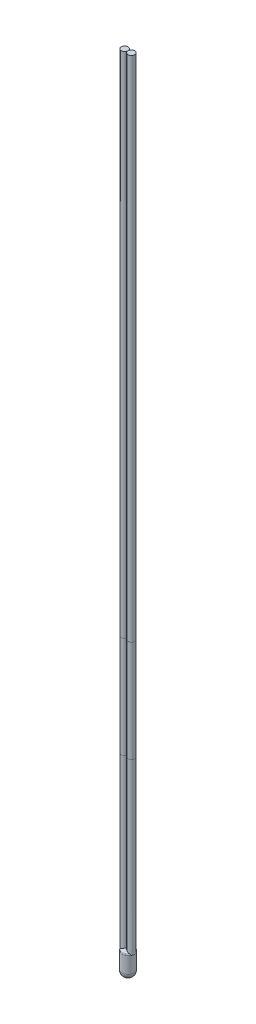
from build123d import *

# Parameters (mm, degrees)
REDONDEO1_R               = 0.2
CROQUIS2_R                = 0.5
SALIENTE_EXTRUIR1_DEPTH   = 25
SALIENTE_EXTRUIR6_START   = -25
CROQUIS2_3_R              = 0.5
SALIENTE_EXTRUIR6_DEPTH   = 15
SALIENTE_EXTRUIR6_2_DEPTH = 15
SALIENTE_EXTRUIR7_START   = -40
CROQUIS2_4_R              = 0.5
SALIENTE_EXTRUIR7_DEPTH   = 75
SALIENTE_EXTRUIR7_2_DEPTH = 75


with BuildPart() as part:
    # Croquis1 → Revolución2 (revolve)
    with BuildSketch(Plane.XY):
        with BuildLine():
            Line((0, 0), (0, 2.5))
            ThreePointArc((0, 2.5), (0.411039098, 2.782931151), (0.9, 2.882532421))
            Line((0.9, 2.882532421), (0.9, -0.9))
            ThreePointArc((0.9, -0.9), (0.263603897, -0.636396103), (0, 0))
        make_face()
    revolve(axis=Axis((0.9, 2.882532421, 0), (0, -1, 0)))

    # Redondeo1
    redondeo1_edges = [part.edges().sort_by_distance(p)[0] for p in [
        (1.8, 2.5, 0),
    ]]
    fillet(redondeo1_edges, radius=REDONDEO1_R)

    # Croquis2 → Saliente-Extruir1 (add)
    with BuildSketch(Plane(origin=(0, 2.415156213, 0), x_dir=(-1, 0, 0), z_dir=(0, -1, 0))):
        with Locations((-1.41, 0)):
            Circle(CROQUIS2_R)
        with Locations((-0.4, 0)):
            Circle(CROQUIS2_R)
    extrude(amount=-SALIENTE_EXTRUIR1_DEPTH)


with BuildPart() as body_2:
    # Croquis2<3> → Saliente-Extruir6 (new body)
    with BuildSketch(Plane(origin=(0, 2.415156213, 0), x_dir=(-1, 0, 0), z_dir=(0, -1, 0)).offset(SALIENTE_EXTRUIR6_START)):
        with Locations((-1.41, 0)):
            Circle(CROQUIS2_3_R)
    extrude(amount=-SALIENTE_EXTRUIR6_DEPTH)


with BuildPart() as body_3:
    # Croquis2<3> → Saliente-Extruir6 2 (new body)
    with BuildSketch(Plane(origin=(0, 2.415156213, 0), x_dir=(-1, 0, 0), z_dir=(0, -1, 0)).offset(SALIENTE_EXTRUIR6_START)):
        with Locations((-0.4, 0)):
            Circle(CROQUIS2_3_R)
    extrude(amount=-SALIENTE_EXTRUIR6_2_DEPTH)


with BuildPart() as body_4:
    # Croquis2<4> → Saliente-Extruir7 (new body)
    with BuildSketch(Plane(origin=(0, 2.415156213, 0), x_dir=(-1, 0, 0), z_dir=(0, -1, 0)).offset(SALIENTE_EXTRUIR7_START)):
        with Locations((-1.41, 0)):
            Circle(CROQUIS2_4_R)
    extrude(amount=-SALIENTE_EXTRUIR7_DEPTH)


with BuildPart() as body_5:
    # Croquis2<4> → Saliente-Extruir7 2 (new body)
    with BuildSketch(Plane(origin=(0, 2.415156213, 0), x_dir=(-1, 0, 0), z_dir=(0, -1, 0)).offset(SALIENTE_EXTRUIR7_START)):
        with Locations((-0.4, 0)):
            Circle(CROQUIS2_4_R)
    extrude(amount=-SALIENTE_EXTRUIR7_2_DEPTH)


solid = Compound([part.part, body_2.part, body_3.part, body_4.part, body_5.part])
